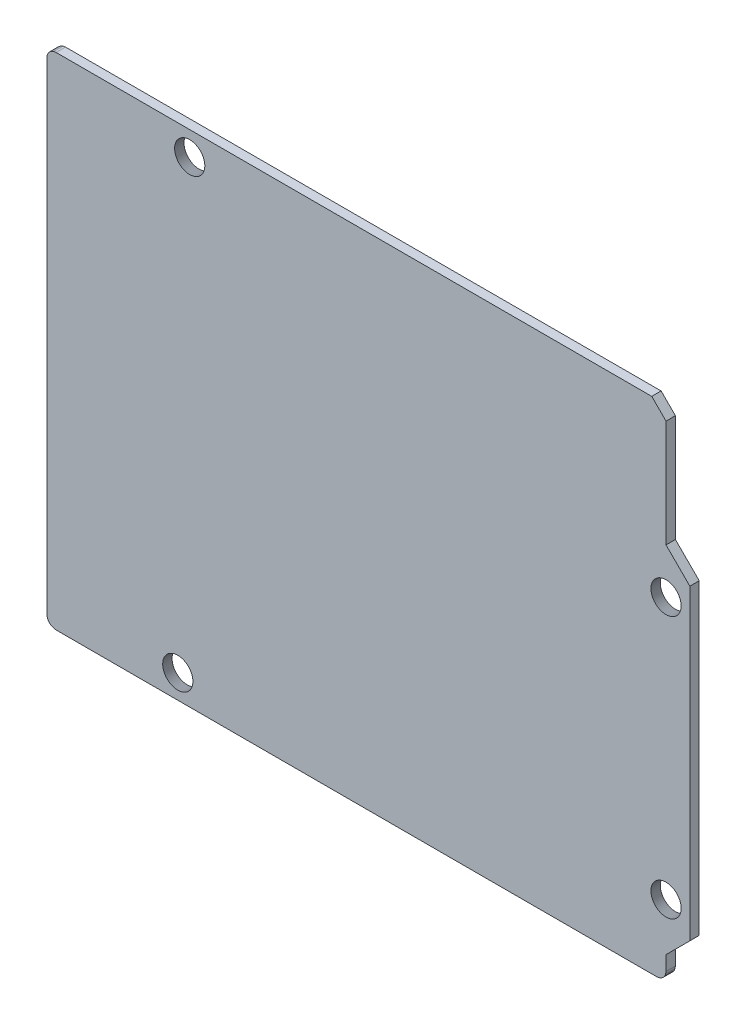
from build123d import *

# Parameters (mm, degrees)
EXTRUDE_1_DEPTH = 1


with BuildPart() as part:
    # Model → Бобышка-Вытянуть1 (new body)
    with BuildSketch(Plane.XY):
        Polygon((0.994481937, 211.988616248), (64.472052402, 211.988616248), (65.995514093, 210.465154557), (65.995514093, 199.039191874), (68.534616911, 196.500089055), (68.534616911, 163.766821886), (65.995514093, 161.227719067), (65.995514093, 159.683098186), (65.953195713, 159.429187904), (65.868558952, 159.196436812), (65.699285431, 158.984844911), (65.487693529, 158.815571389), (65.254942437, 158.730934629), (65.001032156, 158.688616248), (0.994481937, 158.688616248), (0.740571655, 158.730934629), (0.507820564, 158.815571389), (0.296228662, 158.984844911), (0.126955141, 159.196436812), (0.04231838, 159.429187904), (0, 159.683098186), (0, 210.972975121), (0.04231838, 211.248044593), (0.126955141, 211.480795685), (0.296228662, 211.692387586), (0.507820564, 211.840501917), (0.740571655, 211.946297868), align=None)
        Polygon((15.234616911, 207.841414978), (15.290738738, 207.842394589), (15.346792188, 207.845332227), (15.402708971, 207.850224312), (15.458420958, 207.857064885), (15.513860276, 207.865845611), (15.568959378, 207.876555792), (15.623651135, 207.88918238), (15.677868914, 207.903709991), (15.731546658, 207.920120925), (15.784618971, 207.938395188), (15.83702119, 207.958510516), (15.888689473, 207.980442401), (15.939560869, 208.004164123), (15.989573399, 208.029646781), (16.038666132, 208.056859327), (16.086779254, 208.085768608), (16.133854147, 208.116339401), (16.179833459, 208.148534462), (16.22466117, 208.182314565), (16.268282664, 208.217638555), (16.310644796, 208.254463395), (16.351695954, 208.292744219), (16.391386123, 208.332434388), (16.429666947, 208.373485545), (16.466491786, 208.415847677), (16.501815776, 208.459469172), (16.535595879, 208.504296882), (16.56779094, 208.550276194), (16.598361734, 208.597351088), (16.627271014, 208.64546421), (16.654483561, 208.694556942), (16.679966218, 208.744569472), (16.70368794, 208.795440868), (16.725619825, 208.847109151), (16.745735153, 208.899511371), (16.764009417, 208.952583683), (16.780420351, 209.006261428), (16.794947961, 209.060479207), (16.807574549, 209.115170964), (16.81828473, 209.170270066), (16.827065456, 209.225709383), (16.833906029, 209.281421371), (16.838798114, 209.337338153), (16.841735752, 209.393391604), (16.842715363, 209.44951343), (16.841750108, 209.505222767), (16.838855495, 209.560865226), (16.834034998, 209.616374007), (16.827294405, 209.671682473), (16.818641807, 209.726724225), (16.808087593, 209.781433188), (16.795644431, 209.835743681), (16.781327261, 209.889590507), (16.76515327, 209.942909021), (16.747141875, 209.995635216), (16.727314698, 210.047705794), (16.705695542, 210.099058243), (16.682310361, 210.149630916), (16.657187228, 210.199363101), (16.630356304, 210.248195093), (16.601849799, 210.296068271), (16.571701935, 210.342925163), (16.539948904, 210.388709516), (16.506628827, 210.433366368), (16.471781703, 210.476842108), (16.435449367, 210.519084543), (16.397675435, 210.560042961), (16.358505254, 210.599668193), (16.317985849, 210.637912667), (16.276165864, 210.674730472), (16.233095501, 210.710077408), (16.188826469, 210.743911041), (16.14341191, 210.776190754), (16.096906346, 210.806877795), (16.049365606, 210.835935324), (16.000846763, 210.863328459), (15.951408063, 210.889024313), (15.901108857, 210.912992039), (15.85000953, 210.935202864), (15.798171425, 210.955630124), (15.745656776, 210.974249295), (15.692528624, 210.991038026), (15.638850751, 211.005976161), (15.584687596, 211.019045768), (15.530104182, 211.030231157), (15.475166036, 211.039518899), (15.419939112, 211.046897845), (15.364489709, 211.052359136), (15.308884394, 211.055896216), (15.253189922, 211.057504838), (15.197473152, 211.057183072), (15.141800973, 211.054931304), (15.086240219, 211.050752237), (15.03085759, 211.044650888), (14.975719574, 211.036634582), (14.920892363, 211.026712941), (14.866441778, 211.014897878), (14.812433185, 211.001203576), (14.758931423, 210.985646475), (14.706000719, 210.968245252), (14.653704617, 210.949020795), (14.602105899, 210.927996185), (14.551266508, 210.905196661), (14.501247476, 210.880649595), (14.452108852, 210.854384454), (14.403909627, 210.826432769), (14.356707663, 210.796828098), (14.310559626, 210.76560598), (14.265520917, 210.732803897), (14.221645604, 210.698461228), (14.17898636, 210.662619201), (14.137594397, 210.625320845), (14.097519406, 210.586610936), (14.058809497, 210.546535944), (14.02151114, 210.505143981), (13.985669114, 210.462484737), (13.951326444, 210.418609425), (13.918524361, 210.373570715), (13.887302243, 210.327422678), (13.857697572, 210.280220714), (13.829745888, 210.232021489), (13.803480747, 210.182882865), (13.77893368, 210.132863834), (13.756134156, 210.082024443), (13.735109546, 210.030425724), (13.71588509, 209.978129622), (13.698483866, 209.925198919), (13.682926765, 209.871697156), (13.669232463, 209.817688563), (13.6574174, 209.763237978), (13.64749576, 209.708410767), (13.639479453, 209.653272751), (13.633378104, 209.597890123), (13.629199037, 209.542329369), (13.626947269, 209.48665719), (13.626625503, 209.43094042), (13.628234126, 209.375245947), (13.631771206, 209.319640632), (13.637232497, 209.264191229), (13.644611442, 209.208964305), (13.653899184, 209.154026159), (13.665084573, 209.099442746), (13.67815418, 209.045279591), (13.693092316, 208.991601717), (13.709881047, 208.938473566), (13.728500218, 208.885958916), (13.748927477, 208.834120812), (13.771138302, 208.783021484), (13.795106028, 208.732722279), (13.820801882, 208.683283579), (13.848195017, 208.634764735), (13.877252547, 208.587223995), (13.907939588, 208.540718431), (13.9402193, 208.495303873), (13.974052933, 208.45103484), (14.009399869, 208.407964478), (14.046217674, 208.366144492), (14.084462149, 208.325625087), (14.12408738, 208.286454907), (14.165045798, 208.248680975), (14.207288233, 208.212348638), (14.250763973, 208.177501514), (14.295420825, 208.144181437), (14.341205179, 208.112428407), (14.38806207, 208.082280543), (14.435935248, 208.053774038), (14.48476724, 208.026943114), (14.534499425, 208.001819981), (14.585072098, 207.978434799), (14.636424548, 207.956815643), (14.688495125, 207.936988467), (14.74122132, 207.918977071), (14.794539835, 207.90280308), (14.84838666, 207.88848591), (14.902697154, 207.876042749), (14.957406116, 207.865488534), (15.012447869, 207.856835936), (15.067756334, 207.850095343), (15.123265116, 207.845274846), (15.178907574, 207.842380233), align=None, mode=Mode.SUBTRACT)
        Polygon((65.995514093, 192.606798067), (66.051635919, 192.607777678), (66.10768937, 192.610715315), (66.163606152, 192.615607401), (66.21931814, 192.622447974), (66.274757457, 192.6312287), (66.329856559, 192.641938881), (66.384548316, 192.654565468), (66.438766095, 192.669093079), (66.49244384, 192.685504013), (66.545516152, 192.703778276), (66.597918372, 192.723893604), (66.649586654, 192.74582549), (66.70045805, 192.769547212), (66.750470581, 192.795029869), (66.799563313, 192.822242415), (66.847676435, 192.851151696), (66.894751329, 192.88172249), (66.94073064, 192.913917551), (66.985558351, 192.947697654), (67.029179846, 192.983021644), (67.071541977, 193.019846483), (67.112593135, 193.058127307), (67.152283304, 193.097817476), (67.190564128, 193.138868634), (67.227388968, 193.181230766), (67.262712958, 193.22485226), (67.296493061, 193.269679971), (67.328688122, 193.315659282), (67.359258915, 193.362734176), (67.388168196, 193.410847298), (67.415380742, 193.45994003), (67.4408634, 193.509952561), (67.464585122, 193.560823957), (67.486517007, 193.61249224), (67.506632335, 193.664894459), (67.524906598, 193.717966771), (67.541317532, 193.771644516), (67.555845143, 193.825862295), (67.568471731, 193.880554052), (67.579181912, 193.935653154), (67.587962638, 193.991092471), (67.594803211, 194.046804459), (67.599695296, 194.102721242), (67.602632934, 194.158774692), (67.603612545, 194.214896518), (67.60264729, 194.270605856), (67.599752677, 194.326248314), (67.59493218, 194.381757096), (67.588191586, 194.437065561), (67.579538989, 194.492107314), (67.568984774, 194.546816276), (67.556541613, 194.60112677), (67.542224443, 194.654973595), (67.526050452, 194.70829211), (67.508039056, 194.761018305), (67.488211879, 194.813088882), (67.466592723, 194.864441332), (67.443207542, 194.915014005), (67.418084409, 194.964746189), (67.391253485, 195.013578182), (67.36274698, 195.06145136), (67.332599116, 195.108308251), (67.300846086, 195.154092605), (67.267526008, 195.198749457), (67.232678884, 195.242225197), (67.196346548, 195.284467632), (67.158572616, 195.32542605), (67.119402436, 195.365051281), (67.078883031, 195.403295756), (67.037063045, 195.440113561), (66.993992683, 195.475460496), (66.94972365, 195.509294129), (66.904309091, 195.541573842), (66.857803527, 195.572260883), (66.810262787, 195.601318413), (66.761743944, 195.628711547), (66.712305244, 195.654407402), (66.662006038, 195.678375128), (66.610906711, 195.700585953), (66.559068607, 195.721013212), (66.506553957, 195.739632383), (66.453425805, 195.756421114), (66.399747932, 195.77135925), (66.345584777, 195.784428857), (66.291001363, 195.795614245), (66.236063218, 195.804901988), (66.180836294, 195.812280933), (66.125386891, 195.817742224), (66.069781576, 195.821279304), (66.014087103, 195.822887927), (65.958370333, 195.822566161), (65.902698154, 195.820314393), (65.8471374, 195.816135326), (65.791754772, 195.810033977), (65.736616756, 195.80201767), (65.681789545, 195.79209603), (65.627338959, 195.780280967), (65.573330367, 195.766586665), (65.519828604, 195.751029564), (65.4668979, 195.73362834), (65.414601799, 195.714403884), (65.36300308, 195.693379274), (65.312163689, 195.67057975), (65.262144658, 195.646032683), (65.213006034, 195.619767542), (65.164806808, 195.591815858), (65.117604844, 195.562211187), (65.071456807, 195.530989068), (65.026418098, 195.498186985), (64.982542785, 195.463844316), (64.939883541, 195.42800229), (64.898491578, 195.390703933), (64.858416587, 195.351994024), (64.819706678, 195.311919033), (64.782408322, 195.27052707), (64.746566295, 195.227867826), (64.712223626, 195.183992513), (64.679421543, 195.138953804), (64.648199425, 195.092805767), (64.618594753, 195.045603803), (64.590643069, 194.997404577), (64.564377928, 194.948265954), (64.539830861, 194.898246922), (64.517031338, 194.847407531), (64.496006727, 194.795808813), (64.476782271, 194.743512711), (64.459381047, 194.690582007), (64.443823946, 194.637080245), (64.430129644, 194.583071652), (64.418314581, 194.528621066), (64.408392941, 194.473793856), (64.400376635, 194.41865584), (64.394275286, 194.363273211), (64.390096219, 194.307712457), (64.387844451, 194.252040278), (64.387522685, 194.196323508), (64.389131307, 194.140629035), (64.392668387, 194.08502372), (64.398129678, 194.029574318), (64.405508624, 193.974347393), (64.414796366, 193.919409248), (64.425981754, 193.864825834), (64.439051362, 193.810662679), (64.453989497, 193.756984806), (64.470778228, 193.703856654), (64.489397399, 193.651342004), (64.509824659, 193.5995039), (64.532035484, 193.548404573), (64.55600321, 193.498105367), (64.581699064, 193.448666667), (64.609092198, 193.400147824), (64.638149728, 193.352607084), (64.668836769, 193.30610152), (64.701116482, 193.260686961), (64.734950115, 193.216417929), (64.770297051, 193.173347566), (64.807114856, 193.13152758), (64.84535933, 193.091008176), (64.884984561, 193.051837995), (64.92594298, 193.014064063), (64.968185415, 192.977731727), (65.011661154, 192.942884603), (65.056318006, 192.909564526), (65.10210236, 192.877811495), (65.148959252, 192.847663631), (65.196832429, 192.819157126), (65.245664422, 192.792326202), (65.295396606, 192.767203069), (65.34596928, 192.743817888), (65.397321729, 192.722198732), (65.449392307, 192.702371555), (65.502118502, 192.68436016), (65.555437016, 192.668186169), (65.609283842, 192.653868999), (65.663594335, 192.641425837), (65.718303297, 192.630871622), (65.77334505, 192.622219025), (65.828653516, 192.615478432), (65.884162297, 192.610657935), (65.939804756, 192.607763321), align=None, mode=Mode.SUBTRACT)
        Polygon((13.965065502, 159.619620615), (14.021187329, 159.620600226), (14.077240779, 159.623537864), (14.133157561, 159.628429949), (14.188869549, 159.635270522), (14.244308866, 159.644051248), (14.299407968, 159.654761429), (14.354099726, 159.667388017), (14.408317505, 159.681915628), (14.461995249, 159.698326562), (14.515067562, 159.716600825), (14.567469781, 159.736716153), (14.619138064, 159.758648038), (14.67000946, 159.78236976), (14.72002199, 159.807852418), (14.769114722, 159.835064964), (14.817227845, 159.863974245), (14.864302738, 159.894545038), (14.91028205, 159.926740099), (14.95510976, 159.960520202), (14.998731255, 159.995844192), (15.041093387, 160.032669032), (15.082144544, 160.070949856), (15.121834713, 160.110640025), (15.160115537, 160.151691182), (15.196940377, 160.194053314), (15.232264367, 160.237674809), (15.26604447, 160.28250252), (15.298239531, 160.328481831), (15.328810324, 160.375556725), (15.357719605, 160.423669847), (15.384932151, 160.472762579), (15.410414809, 160.522775109), (15.434136531, 160.573646505), (15.456068416, 160.625314788), (15.476183744, 160.677717008), (15.494458007, 160.73078932), (15.510868941, 160.784467065), (15.525396552, 160.838684844), (15.53802314, 160.893376601), (15.548733321, 160.948475703), (15.557514047, 161.00391502), (15.56435462, 161.059627008), (15.569246705, 161.11554379), (15.572184343, 161.171597241), (15.573163954, 161.227719067), (15.572198699, 161.283428404), (15.569304086, 161.339070863), (15.564483589, 161.394579644), (15.557742996, 161.44988811), (15.549090398, 161.504929863), (15.538536183, 161.559638825), (15.526093022, 161.613949318), (15.511775852, 161.667796144), (15.495601861, 161.721114658), (15.477590466, 161.773840853), (15.457763289, 161.825911431), (15.436144133, 161.87726388), (15.412758951, 161.927836554), (15.387635818, 161.977568738), (15.360804894, 162.026400731), (15.332298389, 162.074273908), (15.302150525, 162.1211308), (15.270397495, 162.166915154), (15.237077418, 162.211572006), (15.202230294, 162.255047745), (15.165897957, 162.29729018), (15.128124025, 162.338248599), (15.088953845, 162.37787383), (15.04843444, 162.416118304), (15.006614454, 162.452936109), (14.963544092, 162.488283045), (14.919275059, 162.522116678), (14.873860501, 162.554396391), (14.827354937, 162.585083432), (14.779814197, 162.614140961), (14.731295353, 162.641534096), (14.681856653, 162.66722995), (14.631557448, 162.691197676), (14.58045812, 162.713408501), (14.528620016, 162.733835761), (14.476105366, 162.752454932), (14.422977215, 162.769243663), (14.369299341, 162.784181798), (14.315136186, 162.797251405), (14.260552773, 162.808436794), (14.205614627, 162.817724536), (14.150387703, 162.825103482), (14.0949383, 162.830564773), (14.039332985, 162.834101853), (13.983638512, 162.835710475), (13.927921742, 162.835388709), (13.872249563, 162.833136941), (13.816688809, 162.828957874), (13.761306181, 162.822856525), (13.706168165, 162.814840219), (13.651340954, 162.804918579), (13.596890369, 162.793103516), (13.542881776, 162.779409214), (13.489380013, 162.763852113), (13.43644931, 162.746450889), (13.384153208, 162.727226432), (13.332554489, 162.706201822), (13.281715098, 162.683402299), (13.231696067, 162.658855232), (13.182557443, 162.632590091), (13.134358218, 162.604638407), (13.087156254, 162.575033735), (13.041008217, 162.543811617), (12.995969507, 162.511009534), (12.952094195, 162.476666865), (12.909434951, 162.440824838), (12.868042988, 162.403526482), (12.827967997, 162.364816573), (12.789258087, 162.324741582), (12.751959731, 162.283349619), (12.716117704, 162.240690375), (12.681775035, 162.196815062), (12.648972952, 162.151776353), (12.617750834, 162.105628316), (12.588146163, 162.058426352), (12.560194478, 162.010227126), (12.533929337, 161.961088502), (12.509382271, 161.911069471), (12.486582747, 161.86023008), (12.465558137, 161.808631361), (12.44633368, 161.756335259), (12.428932457, 161.703404556), (12.413375356, 161.649902793), (12.399681054, 161.595894201), (12.387865991, 161.541443615), (12.37794435, 161.486616404), (12.369928044, 161.431478388), (12.363826695, 161.37609576), (12.359647628, 161.320535006), (12.35739586, 161.264862827), (12.357074094, 161.209146057), (12.358682716, 161.153451584), (12.362219796, 161.097846269), (12.367681087, 161.042396866), (12.375060033, 160.987169942), (12.384347775, 160.932231797), (12.395533164, 160.877648383), (12.408602771, 160.823485228), (12.423540906, 160.769807355), (12.440329637, 160.716679203), (12.458948809, 160.664164553), (12.479376068, 160.612326449), (12.501586893, 160.561227122), (12.525554619, 160.510927916), (12.551250473, 160.461489216), (12.578643608, 160.412970373), (12.607701137, 160.365429633), (12.638388178, 160.318924068), (12.670667891, 160.27350951), (12.704501524, 160.229240477), (12.73984846, 160.186170115), (12.776666265, 160.144350129), (12.814910739, 160.103830724), (12.854535971, 160.064660544), (12.895494389, 160.026886612), (12.937736824, 159.990554275), (12.981212564, 159.955707152), (13.025869416, 159.922387074), (13.071653769, 159.890634044), (13.118510661, 159.86048618), (13.166383839, 159.831979675), (13.215215831, 159.805148751), (13.264948016, 159.780025618), (13.315520689, 159.756640437), (13.366873138, 159.735021281), (13.418943716, 159.715194104), (13.471669911, 159.697182708), (13.524988425, 159.681008717), (13.578835251, 159.666691547), (13.633145745, 159.654248386), (13.687854707, 159.643694171), (13.742896459, 159.635041573), (13.798204925, 159.62830098), (13.853713706, 159.623480483), (13.909356165, 159.62058587), align=None, mode=Mode.SUBTRACT)
        Polygon((65.995514093, 164.697826252), (66.051635919, 164.698805863), (66.10768937, 164.701743501), (66.163606152, 164.706635587), (66.21931814, 164.713476159), (66.274757457, 164.722256885), (66.329856559, 164.732967067), (66.384548316, 164.745593654), (66.438766095, 164.760121265), (66.49244384, 164.776532199), (66.545516152, 164.794806462), (66.597918372, 164.81492179), (66.649586654, 164.836853676), (66.70045805, 164.860575398), (66.750470581, 164.886058055), (66.799563313, 164.913270601), (66.847676435, 164.942179882), (66.894751329, 164.972750676), (66.94073064, 165.004945736), (66.985558351, 165.03872584), (67.029179846, 165.074049829), (67.071541977, 165.110874669), (67.112593135, 165.149155493), (67.152283304, 165.188845662), (67.190564128, 165.22989682), (67.227388968, 165.272258952), (67.262712958, 165.315880446), (67.296493061, 165.360708157), (67.328688122, 165.406687468), (67.359258915, 165.453762362), (67.388168196, 165.501875484), (67.415380742, 165.550968216), (67.4408634, 165.600980747), (67.464585122, 165.651852143), (67.486517007, 165.703520425), (67.506632335, 165.755922645), (67.524906598, 165.808994957), (67.541317532, 165.862672702), (67.555845143, 165.916890481), (67.568471731, 165.971582238), (67.579181912, 166.02668134), (67.587962638, 166.082120657), (67.594803211, 166.137832645), (67.599695296, 166.193749427), (67.602632934, 166.249802878), (67.603612545, 166.305924704), (67.60264729, 166.361634042), (67.599752677, 166.4172765), (67.59493218, 166.472785281), (67.588191586, 166.528093747), (67.579538989, 166.5831355), (67.568984774, 166.637844462), (67.556541613, 166.692154955), (67.542224443, 166.746001781), (67.526050452, 166.799320296), (67.508039056, 166.85204649), (67.488211879, 166.904117068), (67.466592723, 166.955469517), (67.443207542, 167.006042191), (67.418084409, 167.055774375), (67.391253485, 167.104606368), (67.36274698, 167.152479546), (67.332599116, 167.199336437), (67.300846086, 167.245120791), (67.267526008, 167.289777643), (67.232678884, 167.333253382), (67.196346548, 167.375495817), (67.158572616, 167.416454236), (67.119402436, 167.456079467), (67.078883031, 167.494323941), (67.037063045, 167.531141746), (66.993992683, 167.566488682), (66.94972365, 167.600322315), (66.904309091, 167.632602028), (66.857803527, 167.663289069), (66.810262787, 167.692346599), (66.761743944, 167.719739733), (66.712305244, 167.745435587), (66.662006038, 167.769403314), (66.610906711, 167.791614138), (66.559068607, 167.812041398), (66.506553957, 167.830660569), (66.453425805, 167.8474493), (66.399747932, 167.862387436), (66.345584777, 167.875457043), (66.291001363, 167.886642431), (66.236063218, 167.895930173), (66.180836294, 167.903309119), (66.125386891, 167.90877041), (66.069781576, 167.91230749), (66.014087103, 167.913916112), (65.958370333, 167.913594347), (65.902698154, 167.911342578), (65.8471374, 167.907163511), (65.791754772, 167.901062162), (65.736616756, 167.893045856), (65.681789545, 167.883124216), (65.627338959, 167.871309153), (65.573330367, 167.857614851), (65.519828604, 167.84205775), (65.4668979, 167.824656526), (65.414601799, 167.80543207), (65.36300308, 167.78440746), (65.312163689, 167.761607936), (65.262144658, 167.737060869), (65.213006034, 167.710795728), (65.164806808, 167.682844044), (65.117604844, 167.653239372), (65.071456807, 167.622017254), (65.026418098, 167.589215171), (64.982542785, 167.554872502), (64.939883541, 167.519030475), (64.898491578, 167.481732119), (64.858416587, 167.44302221), (64.819706678, 167.402947219), (64.782408322, 167.361555256), (64.746566295, 167.318896012), (64.712223626, 167.275020699), (64.679421543, 167.22998199), (64.648199425, 167.183833953), (64.618594753, 167.136631989), (64.590643069, 167.088432763), (64.564377928, 167.039294139), (64.539830861, 166.989275108), (64.517031338, 166.938435717), (64.496006727, 166.886836998), (64.476782271, 166.834540897), (64.459381047, 166.781610193), (64.443823946, 166.72810843), (64.430129644, 166.674099838), (64.418314581, 166.619649252), (64.408392941, 166.564822041), (64.400376635, 166.509684025), (64.394275286, 166.454301397), (64.390096219, 166.398740643), (64.387844451, 166.343068464), (64.387522685, 166.287351694), (64.389131307, 166.231657221), (64.392668387, 166.176051906), (64.398129678, 166.120602503), (64.405508624, 166.065375579), (64.414796366, 166.010437434), (64.425981754, 165.95585402), (64.439051362, 165.901690865), (64.453989497, 165.848012992), (64.470778228, 165.79488484), (64.489397399, 165.74237019), (64.509824659, 165.690532086), (64.532035484, 165.639432759), (64.55600321, 165.589133553), (64.581699064, 165.539694853), (64.609092198, 165.49117601), (64.638149728, 165.44363527), (64.668836769, 165.397129706), (64.701116482, 165.351715147), (64.734950115, 165.307446114), (64.770297051, 165.264375752), (64.807114856, 165.222555766), (64.84535933, 165.182036361), (64.884984561, 165.142866181), (64.92594298, 165.105092249), (64.968185415, 165.068759913), (65.011661154, 165.033912789), (65.056318006, 165.000592711), (65.10210236, 164.968839681), (65.148959252, 164.938691817), (65.196832429, 164.910185312), (65.245664422, 164.883354388), (65.295396606, 164.858231255), (65.34596928, 164.834846074), (65.397321729, 164.813226918), (65.449392307, 164.793399741), (65.502118502, 164.775388346), (65.555437016, 164.759214354), (65.609283842, 164.744897184), (65.663594335, 164.732454023), (65.718303297, 164.721899808), (65.77334505, 164.713247211), (65.828653516, 164.706506617), (65.884162297, 164.701686121), (65.939804756, 164.698791507), align=None, mode=Mode.SUBTRACT)
    extrude(amount=EXTRUDE_1_DEPTH)


solid = part.part
